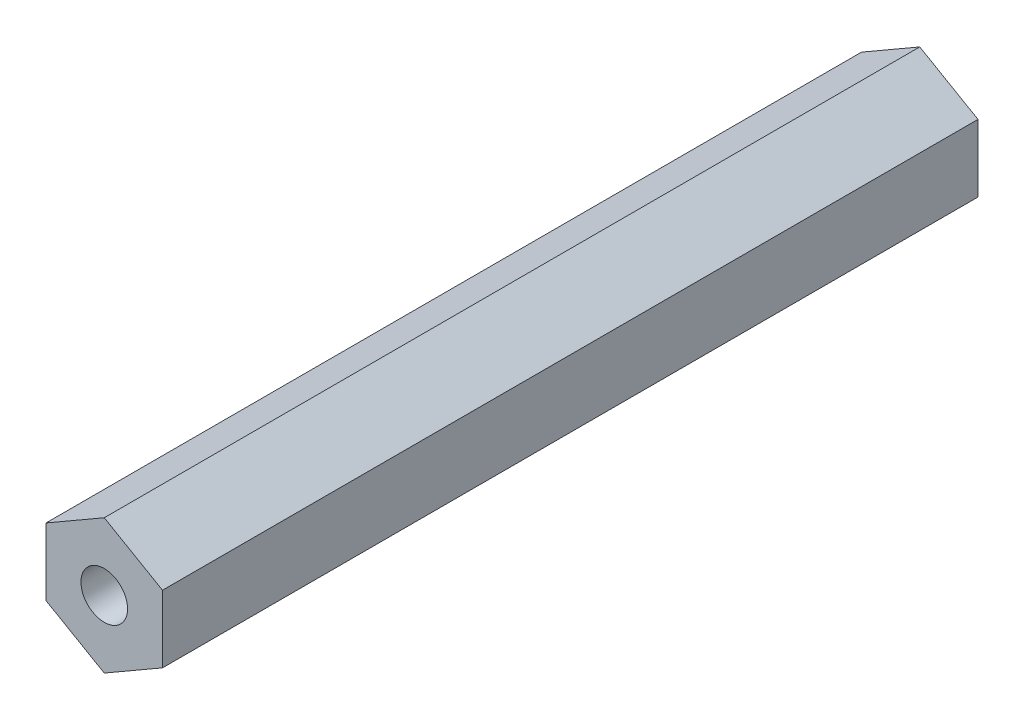
from build123d import *

# Parameters (mm, degrees)
SKETCH1_R           = 1
BOSS_EXTRUDE1_DEPTH = 35


with BuildPart() as part:
    # Sketch1 → Boss-Extrude1 (new body)
    with BuildSketch(Plane.XY):
        Polygon((0, 2.886751346), (-2.5, 1.443375673), (-2.5, -1.443375673), (0, -2.886751346), (2.5, -1.443375673), (2.5, 1.443375673), align=None)
        Circle(SKETCH1_R, mode=Mode.SUBTRACT)
    extrude(amount=BOSS_EXTRUDE1_DEPTH)


solid = part.part
